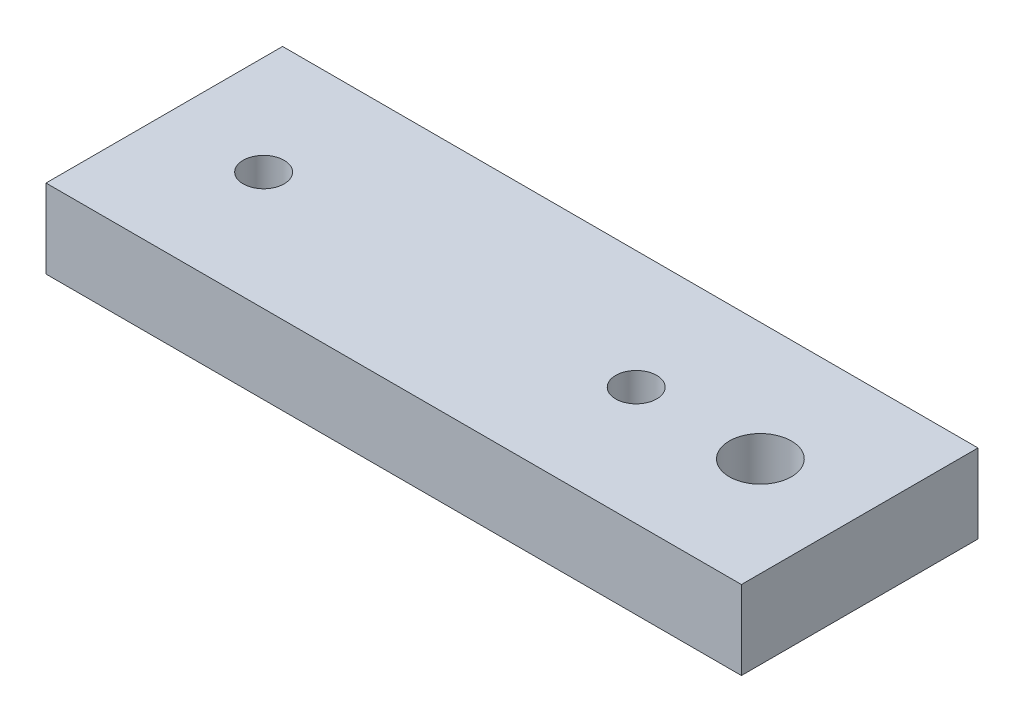
from build123d import *

# Parameters (mm, degrees)
SKETCH1_W             = 56
SKETCH1_H             = 19.05
BOSS_EXTRUDE1_DEPTH   = 6.35
M6X1_0_TAPPED_HOLE1_D = 5
M4X0_7_TAPPED_HOLE1_D = 3.3


with BuildPart() as part:
    # Sketch1 → Boss-Extrude1 (new body)
    with BuildSketch(Plane(origin=(0, 0, 0), x_dir=(1, 0, 0), z_dir=(0, 1, 0))):
        Rectangle(SKETCH1_W, SKETCH1_H)
    extrude(amount=BOSS_EXTRUDE1_DEPTH)

    # M6x1.0 Tapped Hole1 (through all)
    with Locations(Plane(origin=(20, 6.35, 0), x_dir=(0, 0, 1), z_dir=(0, 1, 0))):
        with Locations((0, 0)):
            Hole(M6X1_0_TAPPED_HOLE1_D / 2)

    # M4x0.7 Tapped Hole1 (through all)
    with Locations(Plane(origin=(-20, 6.35, 0), x_dir=(0, 0, 1), z_dir=(0, 1, 0))):
        with Locations((0, 0), (0, 30)):
            Hole(M4X0_7_TAPPED_HOLE1_D / 2)


solid = part.part
